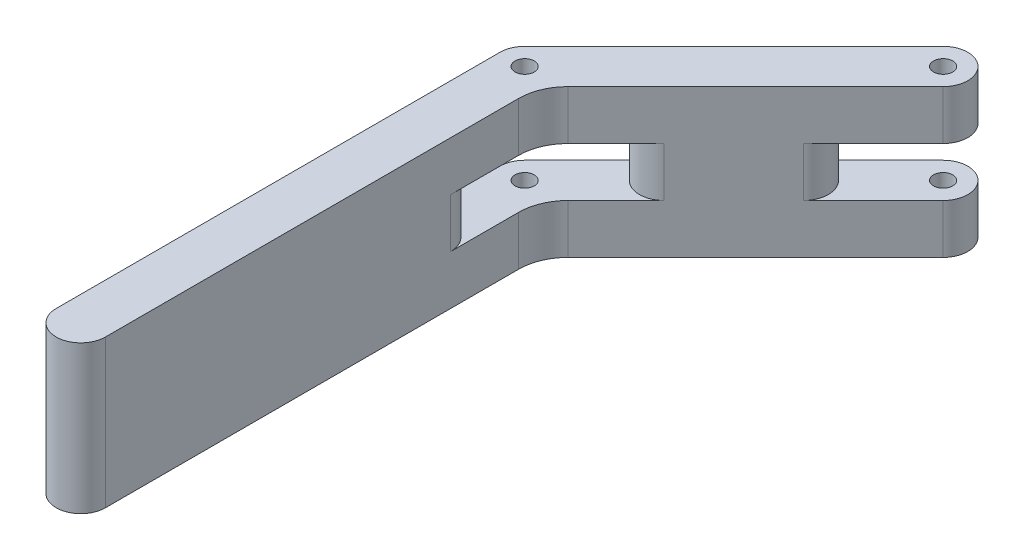
from build123d import *

# Parameters (mm, degrees)
ESQUISSE2_R        = 1.95
BOSS_EXTRU_1_DEPTH = 10
CONG_1_R           = 10
BOSS_EXTRU_2_DEPTH = 10
ESQUISSE4_R        = 1.95
BOSS_EXTRU_3_DEPTH = 10


with BuildPart() as part:
    # Esquisse2 → Boss.-Extru.1 (new body)
    # profile 1 of 3: a face of its own
    with BuildSketch(Plane(origin=(0, 0, 0), x_dir=(1, 0, 0), z_dir=(0, 1, 0))):
        with BuildLine():
            Line((-5, 90), (-5, 0))
            ThreePointArc((-5, 0), (0, -5), (5, 0))
            Line((5, 0), (5, 87.928932188))
            Line((5, 87.928932188), (3.535533906, 86.464466094))
            ThreePointArc((3.535533906, 86.464466094), (-1.913417162, 85.380602337), (-5, 90))
        make_face()
    # profile 2 of 3: a face of its own
    with BuildSketch(Plane(origin=(0, 0, 0), x_dir=(1, 0, 0), z_dir=(0, 1, 0))):
        with BuildLine():
            Line((38.890872965, 135.961940777), (-3.535533906, 93.535533906))
            ThreePointArc((-3.535533906, 93.535533906), (1.913417162, 94.619397663), (5, 90))
            Line((5, 90), (5, 87.928932188))
            Line((5, 87.928932188), (45.961940777, 128.890872965))
            ThreePointArc((45.961940777, 128.890872965), (45.961940777, 135.961940777), (38.890872965, 135.961940777))
        make_face()
        with Locations(Location((42.426406871, 132.426406871, 0), (0, 0, 270))):
            Circle(ESQUISSE2_R, mode=Mode.SUBTRACT)
    # profile 3 of 3: a face of its own
    with BuildSketch(Plane(origin=(0, 0, 0), x_dir=(1, 0, 0), z_dir=(0, 1, 0))):
        with BuildLine():
            ThreePointArc((-3.535533906, 93.535533906), (-4.619397663, 91.913417162), (-5, 90))
            ThreePointArc((-5, 90), (-1.913417162, 85.380602337), (3.535533906, 86.464466094))
            Line((3.535533906, 86.464466094), (5, 87.928932188))
            Line((5, 87.928932188), (5, 90))
            ThreePointArc((5, 90), (1.913417162, 94.619397663), (-3.535533906, 93.535533906))
        make_face()
        with Locations(Location((0, 90, 0), (0, 0, 270))):
            Circle(ESQUISSE2_R, mode=Mode.SUBTRACT)
    extrude(amount=BOSS_EXTRU_1_DEPTH)

    # Congé1
    cong_1_edges = [part.edges().sort_by_distance(p)[0] for p in [
        (5, 5, -87.928932188),
    ]]
    fillet(cong_1_edges, radius=CONG_1_R)

    # Esquisse3 → Boss.-Extru.2 (add)
    with BuildSketch(Plane(origin=(0, 10, 0), x_dir=(1, 0, 0), z_dir=(0, 1, 0))):
        with BuildLine():
            Line((-5, 0), (-5, 70))
            ThreePointArc((-5, 70), (0, 75), (5, 70))
            Line((5, 70), (5, 0))
            ThreePointArc((5, 0), (0, -5), (-5, 0))
        make_face()
        with BuildLine():
            Line((31.819805153, 114.748737342), (17.67766953, 100.606601718))
            ThreePointArc((17.67766953, 100.606601718), (10.606601718, 100.606601718), (10.606601718, 107.67766953))
            Line((10.606601718, 107.67766953), (24.748737342, 121.819805153))
            ThreePointArc((24.748737342, 121.819805153), (31.819805153, 121.819805153), (31.819805153, 114.748737342))
        make_face()
    extrude(amount=BOSS_EXTRU_2_DEPTH)

    # Esquisse4 → Boss.-Extru.3 (add)
    # profile 1 of 4: a face of its own
    with BuildSketch(Plane(origin=(0, 20, 0), x_dir=(1, 0, 0), z_dir=(0, 1, 0))):
        with BuildLine():
            Line((31.819805153, 114.748737342), (45.961940777, 128.890872965))
            ThreePointArc((45.961940777, 128.890872965), (45.961940777, 135.961940777), (38.890872965, 135.961940777))
            Line((38.890872965, 135.961940777), (24.748737342, 121.819805153))
            ThreePointArc((24.748737342, 121.819805153), (31.819805153, 121.819805153), (31.819805153, 114.748737342))
        make_face()
        with Locations(Location((42.426406871, 132.426406871, 0), (0, 0, 270))):
            Circle(ESQUISSE4_R, mode=Mode.SUBTRACT)
    # profile 2 of 4: a face of its own
    with BuildSketch(Plane(origin=(0, 20, 0), x_dir=(1, 0, 0), z_dir=(0, 1, 0))):
        with BuildLine():
            Line((17.67766953, 100.606601718), (31.819805153, 114.748737342))
            ThreePointArc((31.819805153, 114.748737342), (31.819805153, 121.819805153), (24.748737342, 121.819805153))
            Line((24.748737342, 121.819805153), (10.606601718, 107.67766953))
            ThreePointArc((10.606601718, 107.67766953), (10.606601718, 100.606601718), (17.67766953, 100.606601718))
        make_face()
    # profile 3 of 4: a face of its own
    with BuildSketch(Plane(origin=(0, 20, 0), x_dir=(1, 0, 0), z_dir=(0, 1, 0))):
        with BuildLine():
            ThreePointArc((7.928932188, 90.857864376), (5.761204675, 87.613630888), (5, 83.786796564))
            Line((5, 83.786796564), (5, 70))
            ThreePointArc((5, 70), (0, 75), (-5, 70))
            Line((-5, 70), (-5, 90))
            ThreePointArc((-5, 90), (-4.619397663, 91.913417162), (-3.535533906, 93.535533906))
            Line((-3.535533906, 93.535533906), (10.606601718, 107.67766953))
            ThreePointArc((10.606601718, 107.67766953), (10.606601718, 100.606601718), (17.67766953, 100.606601718))
            Line((17.67766953, 100.606601718), (7.928932188, 90.857864376))
        make_face()
        with Locations(Location((0, 90, 0), (0, 0, 270))):
            Circle(ESQUISSE4_R, mode=Mode.SUBTRACT)
    # profile 4 of 4: a face of its own
    with BuildSketch(Plane(origin=(0, 20, 0), x_dir=(1, 0, 0), z_dir=(0, 1, 0))):
        with BuildLine():
            Line((-5, 70), (-5, 0))
            ThreePointArc((-5, 0), (0, -5), (5, 0))
            Line((5, 0), (5, 70))
            ThreePointArc((5, 70), (0, 75), (-5, 70))
        make_face()
    extrude(amount=BOSS_EXTRU_3_DEPTH)


solid = part.part
